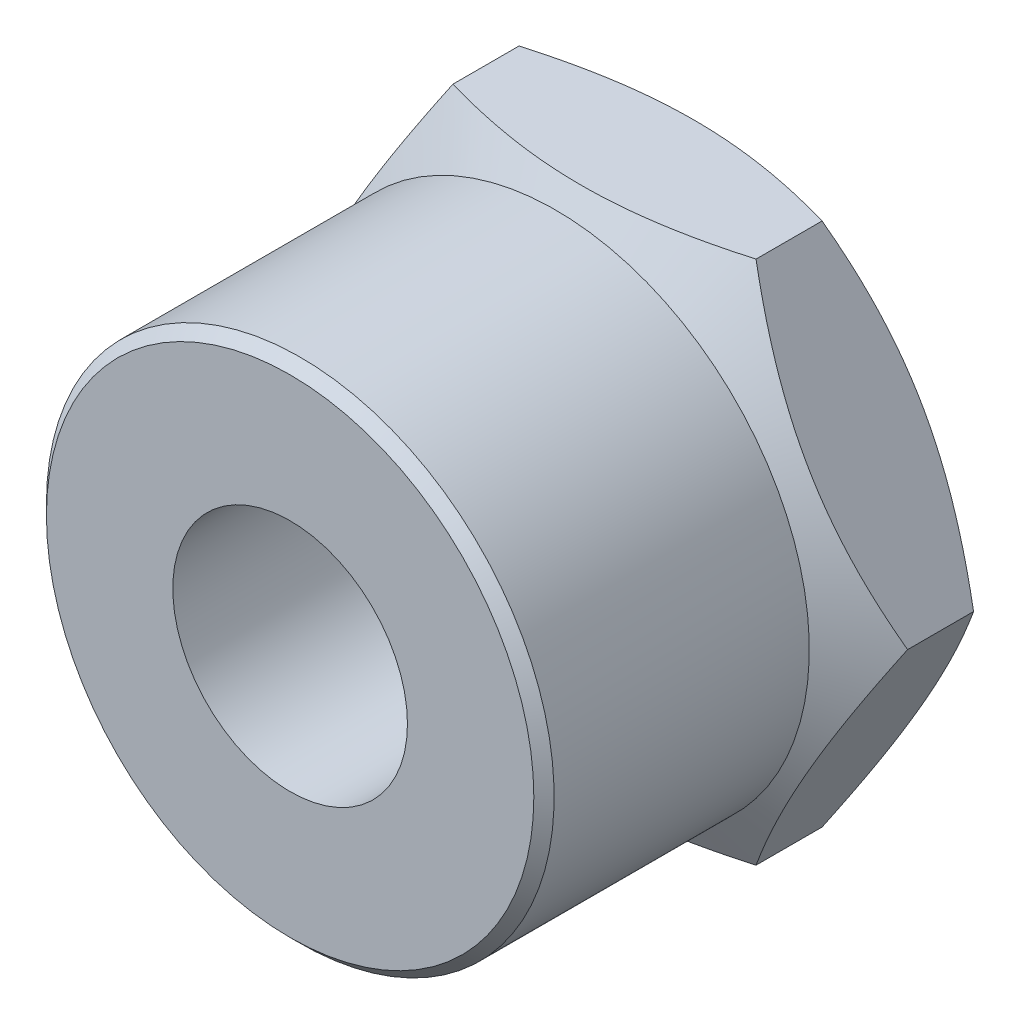
from build123d import *

# Parameters (mm, degrees)
SKETCH1_R      = 1.2295
BASENUT_DEPTH  = 1.72
EXTRUDE1_START = 2.78
SKETCH2_R      = 2.66
SKETCH2_R_2    = 1.2295
EXTRUDE1_DEPTH = 2.78
CHAMFER1_SIZE  = 0.1064


with BuildPart() as part:
    # Sketch1 → BaseNut (new body)
    with BuildSketch(Plane.XY):
        Polygon((1.58771324, -2.75), (3.175426481, 0), (1.58771324, 2.75), (-1.58771324, 2.75), (-3.175426481, 0), (-1.58771324, -2.75), align=None)
        Circle(SKETCH1_R, mode=Mode.SUBTRACT)
    extrude(amount=-BASENUT_DEPTH)

    # Sketch3 → Double-Chamfer (revolve, cut)
    with BuildSketch(Plane(origin=(0, 0, 0), x_dir=(1, 0, 0), z_dir=(0, 1, 0))):
        Polygon((2.285, 1.72), (3.175426481, 1.72), (3.175426481, 1.205912032), align=None)
        Polygon((3.175426481, 0.514087968), (2.285, 0), (3.175426481, 0), align=None)
    revolve(axis=Axis((0, 0, -16.31077227), (0, 0, 1)), mode=Mode.SUBTRACT)

    # Sketch2 → Extrude1 (add)
    with BuildSketch(Plane(origin=(20.087129569, -4.281493882, 0), x_dir=(1, 0, 0), z_dir=(0, 0, 1)).offset(EXTRUDE1_START)):
        with Locations(Location((-20.087129569, 4.281493882, 0), (0, 0, 180))):
            Circle(SKETCH2_R)
        with Locations((-20.087129569, 4.281493882)):
            Circle(SKETCH2_R_2, mode=Mode.SUBTRACT)
    extrude(amount=-EXTRUDE1_DEPTH)

    # Sketch5 → EndChamfer (revolve, cut)
    with BuildSketch(Plane(origin=(0, 0, 0), x_dir=(1, 0, 0), z_dir=(0, 1, 0))):
        Polygon((1.2295, 1.72), (1.725, 1.72), (1.2295, 1.2245), align=None)
    revolve(axis=Axis((0, 0, -16.800797033), (0, 0, 1)), mode=Mode.SUBTRACT)

    # Chamfer1
    chamfer1_edges = [part.edges().sort_by_distance(p)[0] for p in [
        (2.66, 0, 2.78),
    ]]
    chamfer(chamfer1_edges, length=CHAMFER1_SIZE)


solid = part.part
